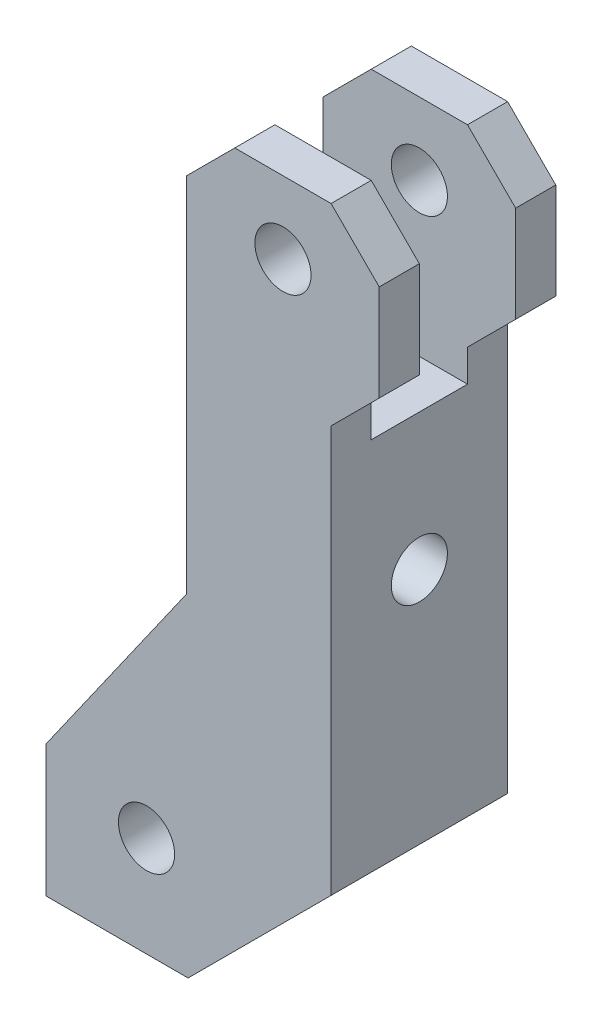
from build123d import *

# Parameters (mm, degrees)
ESQUISSE1_R             = 3.5
BASE_EXTRUSION_DEPTH    = 22
ESQUISSE2_W             = 37.834703774
ESQUISSE2_H             = 34.90934008
ENL_V_MAT_EXTRU_1_DEPTH = 6
ESQUISSE3_R             = 3.5
ENL_V_MAT_EXTRU_2_DEPTH = 91.245498503


with BuildPart() as part:
    # Esquisse1 → Base-Extrusion (new body)
    with BuildSketch(Plane(origin=(0, 0, 0), x_dir=(-1, 0, 0), z_dir=(0, 0, -1))):
        Polygon((12.5, -12.5), (-5.17766953, -12.5), (-23, 5.32233047), (-23, 56), (-29, 62), (-29, 74), (-23, 80), (-11, 80), (-5, 74), (-5, 28.864908166), (12.5, 3.951485697), align=None)
        with Locations(Location((0, 0, 0), (0, 0, 90))):
            Circle(ESQUISSE1_R, mode=Mode.SUBTRACT)
        with Locations(Location((-17, 71, 0), (0, 0, 90))):
            Circle(ESQUISSE1_R, mode=Mode.SUBTRACT)
    extrude(amount=BASE_EXTRUSION_DEPTH)

    # Esquisse2 → Enlèv. mat.-Extru.1 (cut, symmetric)
    with BuildSketch(Plane.XY.offset(-11)):
        with Locations((15.075848619, 69.45467004)):
            Rectangle(ESQUISSE2_W, ESQUISSE2_H)
    extrude(amount=ENL_V_MAT_EXTRU_1_DEPTH, both=True, mode=Mode.SUBTRACT)

    # Esquisse3 → Enlèv. mat.-Extru.2 (cut, through all)
    with BuildSketch(Plane(origin=(23, 0, 0), x_dir=(0, 0, -1), z_dir=(1, 0, 0))):
        with Locations(Location((11, 35, 0), (0, 0, 90))):
            Circle(ESQUISSE3_R)
    extrude(amount=-ENL_V_MAT_EXTRU_2_DEPTH, mode=Mode.SUBTRACT)


solid = part.part
